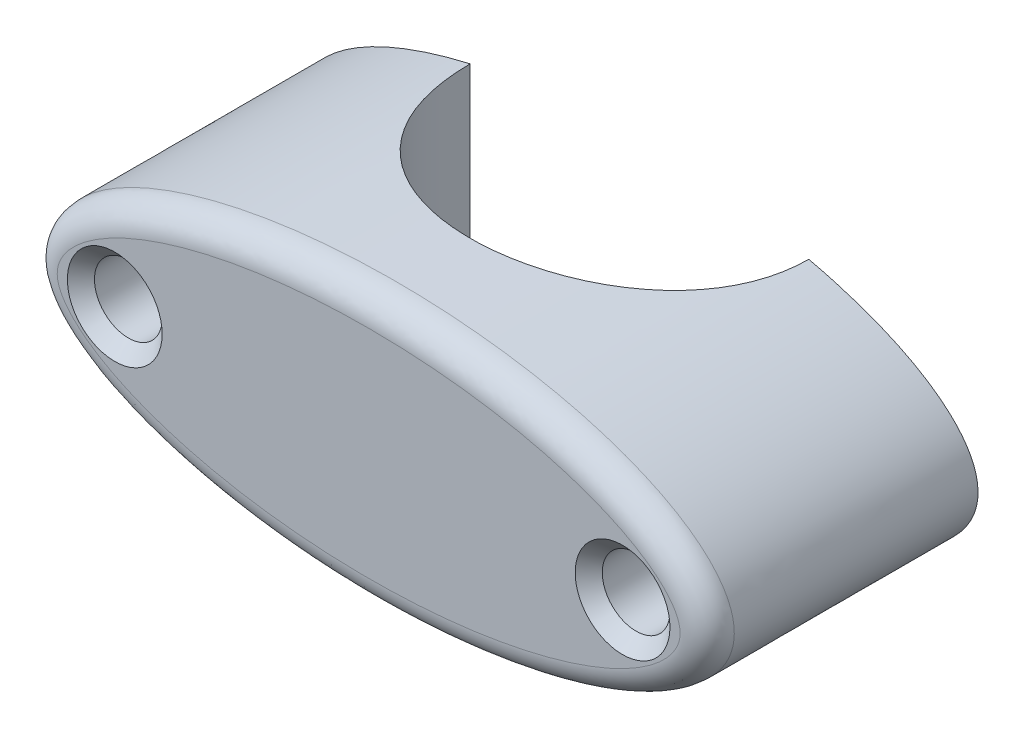
from build123d import *

# Parameters (mm, degrees)
BOSS_EXTRUDE1_DEPTH     = 20
CUT_EXTRUDE1_DEPTH      = 34.541019826
CUT_EXTRUDE1_DEPTH_BACK = 34.541019826
SKETCH3_R               = 12.5
FILLET2_R               = 2
CUT_EXTRUDE3_DEPTH      = 34.541019826
CUT_EXTRUDE3_DEPTH_BACK = 34.541019826
SKETCH5_R               = 2.5
CHAMFER1_SIZE           = 1


with BuildPart() as part:
    # Sketch2 → Boss-Extrude1 (new body)
    with BuildSketch(Plane(origin=(0, 0, 0), x_dir=(0, 1, 0), z_dir=(0, 0, 1))):
        with BuildLine():
            add(Edge.make_bspline(
                [(0, -25), (17.320508076, -25), (8.660254038, 12.5), (0, 50), (-8.660254038, 12.5), (-17.320508076, -25), (0, -25)],
                knots=[0, 0, 0, 2.094395102, 2.094395102, 4.188790205, 4.188790205, 6.283185307, 6.283185307, 6.283185307], degree=2, weights=[1, 0.5, 1, 0.5, 1, 0.5, 1]))
        make_face()
    extrude(amount=-BOSS_EXTRUDE1_DEPTH)

    # Sketch3 → Cut-Extrude1 (cut, two sides: drawn at the far end of the back side and taken through both)
    with BuildSketch(Plane(origin=(0, 0, 0), x_dir=(-1, 0, 0), z_dir=(0, 1, 0)).offset(-CUT_EXTRUDE1_DEPTH_BACK)):
        with Locations((0, -20)):
            Circle(SKETCH3_R)
    extrude(amount=CUT_EXTRUDE1_DEPTH + CUT_EXTRUDE1_DEPTH_BACK, mode=Mode.SUBTRACT)

    # Fillet2
    fillet2_edges = [part.edges().sort_by_distance(p)[0] for p in [
        (-25, 3.1926e-05, 0),
    ]]
    fillet(fillet2_edges, radius=FILLET2_R)

    # Sketch5 → Cut-Extrude3 (cut, two sides: drawn at the far end of the back side and taken through both)
    with BuildSketch(Plane(origin=(0, 0, 0), x_dir=(1, 0, 0), z_dir=(0, 0, -1)).offset(-CUT_EXTRUDE3_DEPTH_BACK)):
        with Locations((-18.75, 0)):
            Circle(SKETCH5_R)
        with Locations((18.75, 0)):
            Circle(SKETCH5_R)
    extrude(amount=CUT_EXTRUDE3_DEPTH + CUT_EXTRUDE3_DEPTH_BACK, mode=Mode.SUBTRACT)

    # Chamfer1
    chamfer1_edges = [part.edges().sort_by_distance(p)[0] for p in [
        (16.25, 0, 0),
        (-21.25, 0, 0),
    ]]
    chamfer(chamfer1_edges, length=CHAMFER1_SIZE)


solid = part.part
